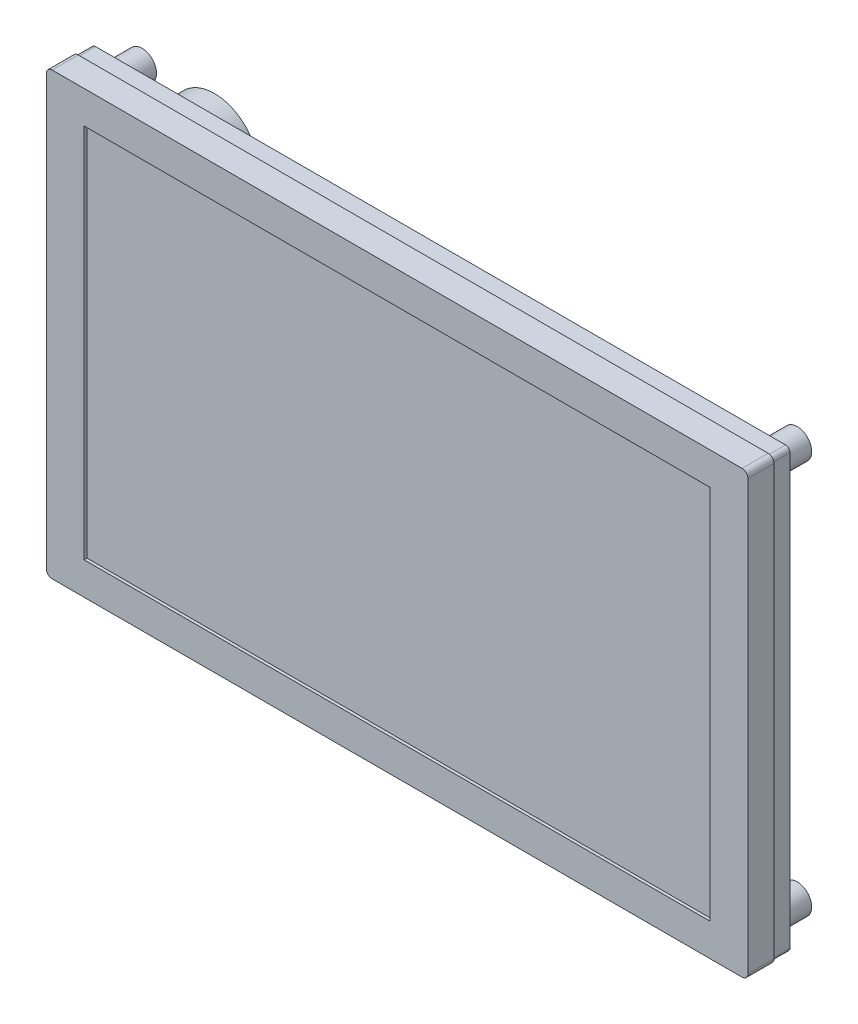
from build123d import *

# Parameters (mm, degrees)
ESQUISSE1_W                     = 121
ESQUISSE1_H                     = 76
BOSS_EXTRU_1_DEPTH              = 7.5
ESQUISSE2_R                     = 2.5
ESQUISSE2_R_2                   = 1.25
EXTRU_MINCE1_DEPTH              = 5
EXTRU_MINCE1_2_DEPTH            = 5
EXTRU_MINCE1_3_DEPTH            = 5
EXTRU_MINCE1_4_DEPTH            = 5
EXTRU_MINCE1_5_DEPTH            = 5
EXTRU_MINCE1_6_DEPTH            = 5
EXTRU_MINCE1_7_DEPTH            = 5
EXTRU_MINCE1_8_DEPTH            = 5
CONG_1_R                        = 1
ESQUISSE3_W                     = 108
ESQUISSE3_H                     = 64.8
ENL_V_MAT_EXTRU_1_DEPTH         = 0.5
ENL_V_DE_MAT_EXTRU_MINCE1_DEPTH = 3
ESQUISSE5_R                     = 7.5
BOSS_EXTRU_2_DEPTH              = 3.5
ESQUISSE6_W                     = 5
ESQUISSE6_H                     = 22
BOSS_EXTRU_3_DEPTH              = 3
ESQUISSE7_W                     = 0.5
ESQUISSE7_H                     = 16


with BuildPart() as part:
    # Esquisse1 → Boss.-Extru.1 (new body)
    with BuildSketch(Plane.XY):
        Rectangle(ESQUISSE1_W, ESQUISSE1_H)
    extrude(amount=-BOSS_EXTRU_1_DEPTH)

    # Congé1
    cong_1_edges = [part.edges().sort_by_distance(p)[0] for p in [
        (-60.5, 38, -3.75),
        (60.5, 38, -3.75),
        (60.5, -38, -3.75),
        (-60.5, -38, -3.75),
    ]]
    fillet(cong_1_edges, radius=CONG_1_R)

    # Esquisse3 → Enlèv. mat.-Extru.1 (cut)
    with BuildSketch(Plane.XY):
        Rectangle(ESQUISSE3_W, ESQUISSE3_H)
    extrude(amount=-ENL_V_MAT_EXTRU_1_DEPTH, mode=Mode.SUBTRACT)

    # Esquisse4 → Enlèv. de mat.-Extru.-Mince1 (cut)
    with BuildSketch(Plane(origin=(0, 0, -7.5), x_dir=(-1, 0, 0), z_dir=(0, 0, -1))):
        with BuildLine():
            Line((-59.5, -38), (59.5, -38))
            ThreePointArc((59.5, -38), (60.207106781, -37.707106781), (60.5, -37))
            Line((60.5, -37), (60.5, 37))
            ThreePointArc((60.5, 37), (60.207106781, 37.707106781), (59.5, 38))
            Line((59.5, 38), (-59.5, 38))
            ThreePointArc((-59.5, 38), (-60.207106781, 37.707106781), (-60.5, 37))
            Line((-60.5, 37), (-60.5, -37))
            ThreePointArc((-60.5, -37), (-60.207106781, -37.707106781), (-59.5, -38))
        make_face()
        with BuildLine():
            Line((-59.5, -37.75), (59.5, -37.75))
            ThreePointArc((59.5, -37.75), (60.030330086, -37.530330086), (60.25, -37))
            Line((60.25, -37), (60.25, 37))
            ThreePointArc((60.25, 37), (60.030330086, 37.530330086), (59.5, 37.75))
            Line((59.5, 37.75), (-59.5, 37.75))
            ThreePointArc((-59.5, 37.75), (-60.030330086, 37.530330086), (-60.25, 37))
            Line((-60.25, 37), (-60.25, -37))
            ThreePointArc((-60.25, -37), (-60.030330086, -37.530330086), (-59.5, -37.75))
        make_face(mode=Mode.SUBTRACT)
    extrude(amount=-ENL_V_DE_MAT_EXTRU_MINCE1_DEPTH, mode=Mode.SUBTRACT)

    # Esquisse5 → Boss.-Extru.2 (add)
    with BuildSketch(Plane(origin=(0, 0, -7.5), x_dir=(-1, 0, 0), z_dir=(0, 0, -1))):
        with Locations(Location((42.5, 30, 0), (0, 0, 180))):
            Circle(ESQUISSE5_R)
    extrude(amount=BOSS_EXTRU_2_DEPTH)

    # Esquisse6 → Boss.-Extru.3 (add)
    with BuildSketch(Plane(origin=(0, 0, -7.5), x_dir=(-1, 0, 0), z_dir=(0, 0, -1))):
        with Locations((45.5, 0)):
            Rectangle(ESQUISSE6_W, ESQUISSE6_H)
    extrude(amount=BOSS_EXTRU_3_DEPTH)


with BuildPart() as body_2:
    # Esquisse2 → Extru.-Mince1 (new body)
    with BuildSketch(Plane(origin=(0, 0, -7.5), x_dir=(-1, 0, 0), z_dir=(0, 0, -1))):
        with Locations((-56.5, 34)):
            Circle(ESQUISSE2_R)
        with Locations((-56.5, 34)):
            Circle(ESQUISSE2_R_2, mode=Mode.SUBTRACT)
    extrude(amount=EXTRU_MINCE1_DEPTH)


with BuildPart() as body_3:
    # Esquisse2 → Extru.-Mince1 2 (new body)
    with BuildSketch(Plane(origin=(0, 0, -7.5), x_dir=(-1, 0, 0), z_dir=(0, 0, -1))):
        with Locations((-56.5, -34)):
            Circle(ESQUISSE2_R)
        with Locations((-56.5, -34)):
            Circle(ESQUISSE2_R_2, mode=Mode.SUBTRACT)
    extrude(amount=EXTRU_MINCE1_2_DEPTH)


with BuildPart() as body_4:
    # Esquisse2 → Extru.-Mince1 3 (new body)
    with BuildSketch(Plane(origin=(0, 0, -7.5), x_dir=(-1, 0, 0), z_dir=(0, 0, -1))):
        with Locations((-29, 24.5)):
            Circle(ESQUISSE2_R)
        with Locations((-29, 24.5)):
            Circle(ESQUISSE2_R_2, mode=Mode.SUBTRACT)
    extrude(amount=EXTRU_MINCE1_3_DEPTH)


with BuildPart() as body_5:
    # Esquisse2 → Extru.-Mince1 4 (new body)
    with BuildSketch(Plane(origin=(0, 0, -7.5), x_dir=(-1, 0, 0), z_dir=(0, 0, -1))):
        with Locations((-29, -24.5)):
            Circle(ESQUISSE2_R)
        with Locations((-29, -24.5)):
            Circle(ESQUISSE2_R_2, mode=Mode.SUBTRACT)
    extrude(amount=EXTRU_MINCE1_4_DEPTH)


with BuildPart() as body_6:
    # Esquisse2 → Extru.-Mince1 5 (new body)
    with BuildSketch(Plane(origin=(0, 0, -7.5), x_dir=(-1, 0, 0), z_dir=(0, 0, -1))):
        with Locations((29, 24.5)):
            Circle(ESQUISSE2_R)
        with Locations((29, 24.5)):
            Circle(ESQUISSE2_R_2, mode=Mode.SUBTRACT)
    extrude(amount=EXTRU_MINCE1_5_DEPTH)


with BuildPart() as body_7:
    # Esquisse2 → Extru.-Mince1 6 (new body)
    with BuildSketch(Plane(origin=(0, 0, -7.5), x_dir=(-1, 0, 0), z_dir=(0, 0, -1))):
        with Locations((29, -24.5)):
            Circle(ESQUISSE2_R)
        with Locations((29, -24.5)):
            Circle(ESQUISSE2_R_2, mode=Mode.SUBTRACT)
    extrude(amount=EXTRU_MINCE1_6_DEPTH)


with BuildPart() as body_8:
    # Esquisse2 → Extru.-Mince1 7 (new body)
    with BuildSketch(Plane(origin=(0, 0, -7.5), x_dir=(-1, 0, 0), z_dir=(0, 0, -1))):
        with Locations((56.5, 34)):
            Circle(ESQUISSE2_R)
        with Locations((56.5, 34)):
            Circle(ESQUISSE2_R_2, mode=Mode.SUBTRACT)
    extrude(amount=EXTRU_MINCE1_7_DEPTH)


with BuildPart() as body_9:
    # Esquisse2 → Extru.-Mince1 8 (new body)
    with BuildSketch(Plane(origin=(0, 0, -7.5), x_dir=(-1, 0, 0), z_dir=(0, 0, -1))):
        with Locations((56.5, -34)):
            Circle(ESQUISSE2_R)
        with Locations((56.5, -34)):
            Circle(ESQUISSE2_R_2, mode=Mode.SUBTRACT)
    extrude(amount=EXTRU_MINCE1_8_DEPTH)


with BuildPart() as body_10:
    # Balayage1: sweep along a path in Esquisse8
    with BuildLine(Plane(origin=(0, 0, 0), x_dir=(1, 0, 0), z_dir=(0, 1, 0))) as balayage1_path:
        Line((-48, 9.5), (-49, 9.5))
        ThreePointArc((-49, 9.5), (-52.043612931, 10.760705754), (-53.304318685, 13.804318685))
        ThreePointArc((-53.304318685, 13.804318685), (-42.430801355, 26.629219131), (-28, 18))
    # Esquisse7 → Balayage1 (sweep)
    with BuildSketch(Plane.ZY.offset(48)):
        with Locations((-9.25, 0)):
            Rectangle(ESQUISSE7_W, ESQUISSE7_H)
    sweep(path=balayage1_path.line)


solid = Compound([part.part, body_2.part, body_3.part, body_4.part, body_5.part, body_6.part, body_7.part, body_8.part, body_9.part, body_10.part])
